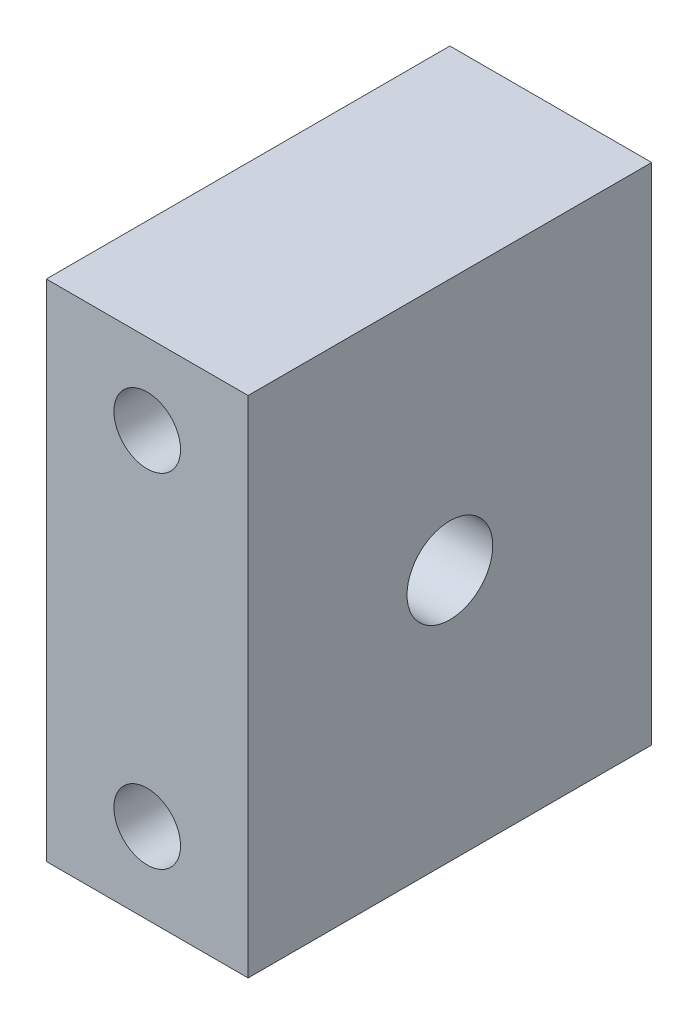
from build123d import *

# Parameters (mm, degrees)
SKETCH_1_W                   = 20
SKETCH_1_H                   = 50
SKETCH_1_R                   = 3.3
SCREW_BRACKET_20X50X40_DEPTH = 40
SKETCH_2_R                   = 4.25
M10_TAP_PILOT_8P5_DEPTH      = 20


with BuildPart() as part:
    # 草图1 → Screw_bracket_20x50x40 (new body)
    with BuildSketch(Plane.XY):
        with Locations((10, 25)):
            Rectangle(SKETCH_1_W, SKETCH_1_H)
        with Locations((10, 8)):
            Circle(SKETCH_1_R, mode=Mode.SUBTRACT)
        with Locations((10, 42)):
            Circle(SKETCH_1_R, mode=Mode.SUBTRACT)
    extrude(amount=SCREW_BRACKET_20X50X40_DEPTH)

    # 草图2 → M10_tap_pilot_8p5 (cut)
    with BuildSketch(Plane.ZY):
        with Locations((20, 25)):
            Circle(SKETCH_2_R)
    extrude(amount=-M10_TAP_PILOT_8P5_DEPTH, mode=Mode.SUBTRACT)


solid = part.part
